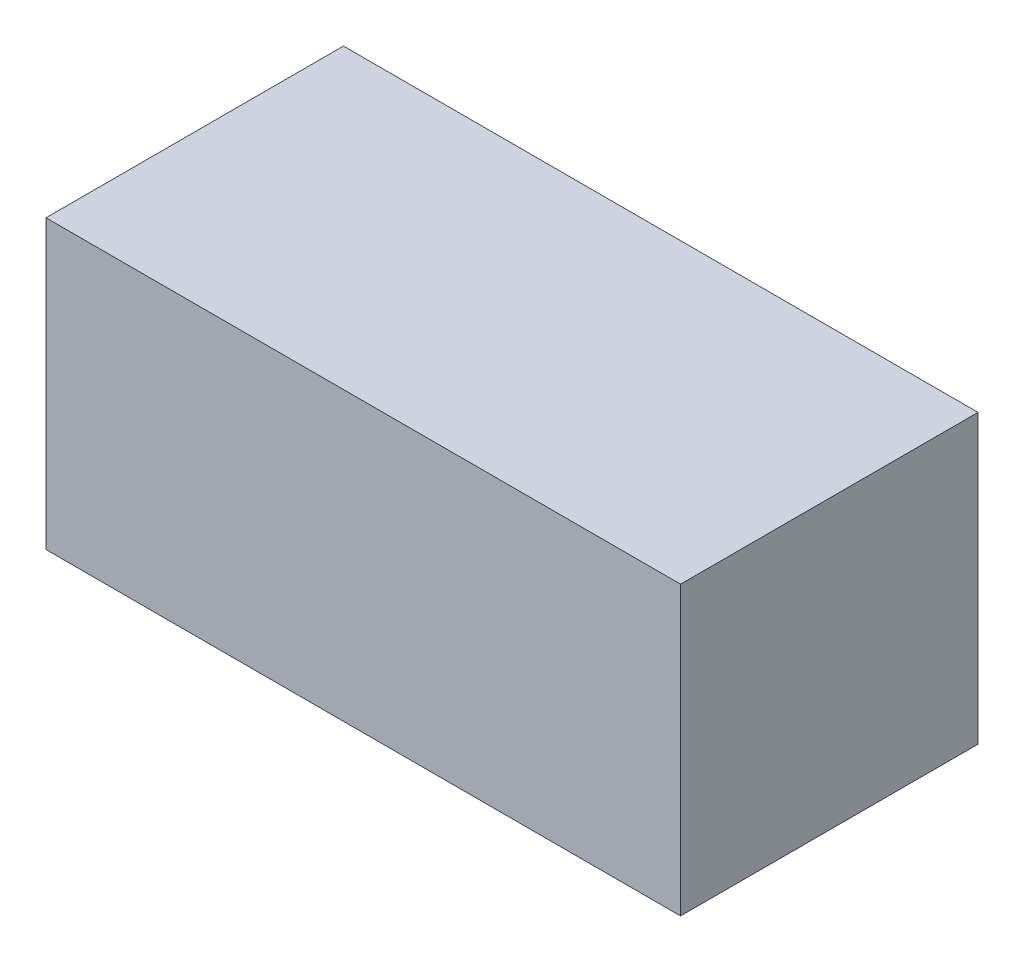
from build123d import *

# Parameters (mm, degrees)
SKETCH1_W               = 2.1332
SKETCH1_H               = 0.966
COMPONENT_OUTLINE_DEPTH = 1


with BuildPart() as part:
    # Sketch1 → Component_Outline (new body)
    with BuildSketch(Plane.XY):
        Rectangle(SKETCH1_W, SKETCH1_H)
    extrude(amount=COMPONENT_OUTLINE_DEPTH)


solid = part.part
